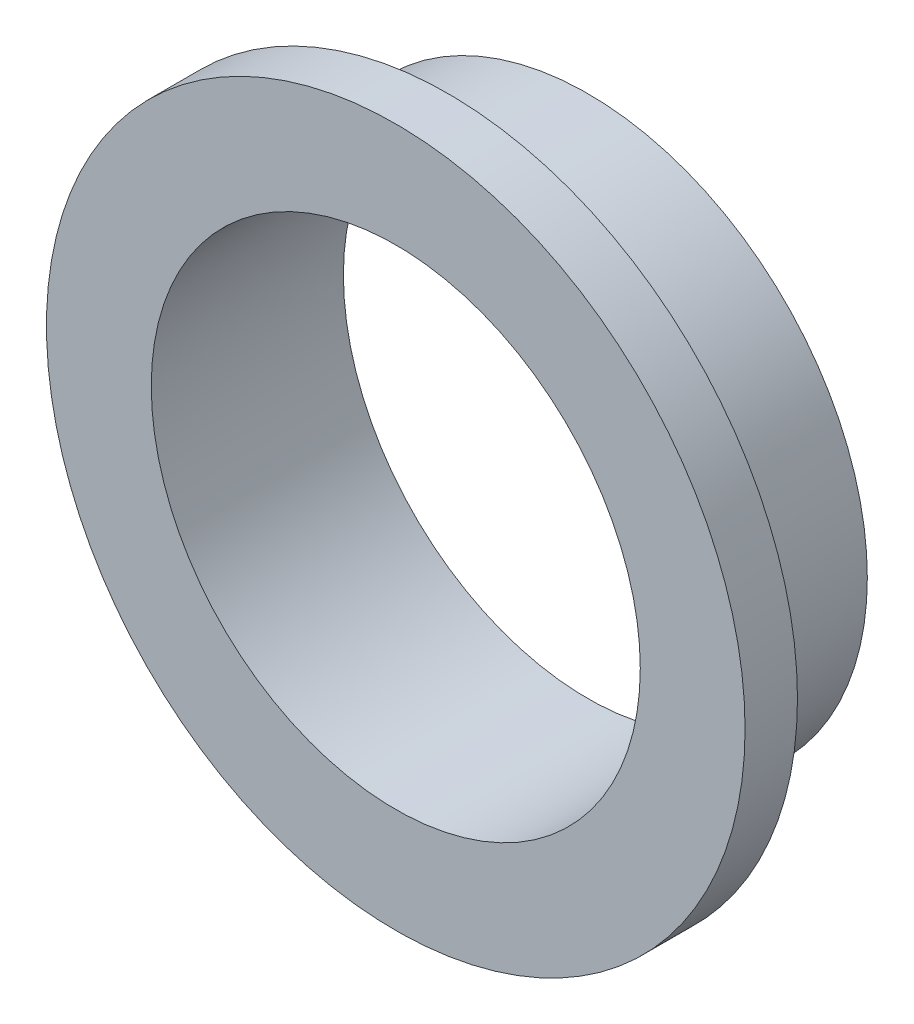
from build123d import *

# Parameters (mm, degrees)
SKETCH_1_R      = 16
SKETCH_1_R_2    = 14
EXTRUDE_1_DEPTH = 8
SKETCH_2_R      = 20
SKETCH_2_R_2    = 14
EXTRUDE_2_DEPTH = 3


with BuildPart() as part:
    # 草图1 → 凸台-拉伸1 (new body)
    with BuildSketch(Plane.XY):
        Circle(SKETCH_1_R)
        Circle(SKETCH_1_R_2, mode=Mode.SUBTRACT)
    extrude(amount=EXTRUDE_1_DEPTH)

    # 草图2 → 凸台-拉伸2 (add)
    with BuildSketch(Plane.XY.offset(8)):
        Circle(SKETCH_2_R)
        Circle(SKETCH_2_R_2, mode=Mode.SUBTRACT)
    extrude(amount=EXTRUDE_2_DEPTH)


solid = part.part
